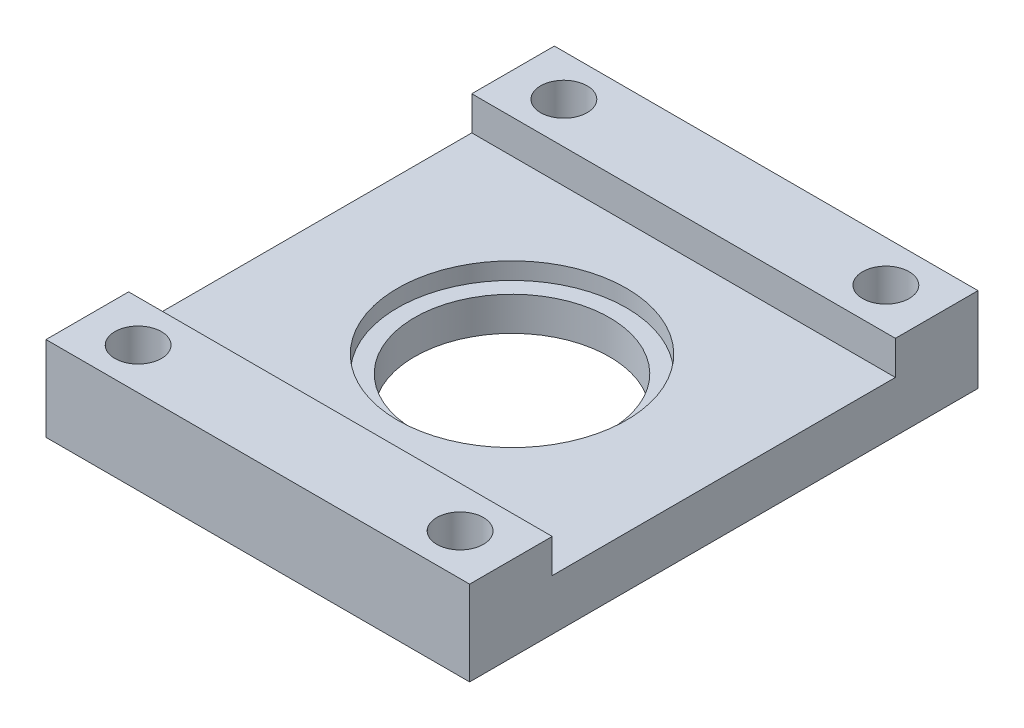
from build123d import *

# Parameters (mm, degrees)
SKETCH1_W           = 63.5
SKETCH1_H           = 76.2
BOSS_EXTRUDE1_DEPTH = 12.7
SKETCH2_W           = 63.5
SKETCH2_H           = 51.435
CUT_EXTRUDE1_DEPTH  = 5.08
SKETCH3_R           = 14.605
CUT_EXTRUDE2_DEPTH  = 7.62
SKETCH4_R           = 3.4925
CUT_EXTRUDE4_DEPTH  = 12.7
SKETCH6_R           = 17.145
CUT_EXTRUDE6_DEPTH  = 2.54


with BuildPart() as part:
    # Sketch1 → Boss-Extrude1 (new body)
    with BuildSketch(Plane(origin=(0, 0, 0), x_dir=(1, 0, 0), z_dir=(0, 1, 0))):
        with Locations((31.75, -38.1)):
            Rectangle(SKETCH1_W, SKETCH1_H)
    extrude(amount=BOSS_EXTRUDE1_DEPTH)

    # Sketch2 → Cut-Extrude1 (cut)
    with BuildSketch(Plane(origin=(0, 12.7, 0), x_dir=(1, 0, 0), z_dir=(0, 1, 0))):
        with Locations((31.75, -38.1)):
            Rectangle(SKETCH2_W, SKETCH2_H)
    extrude(amount=-CUT_EXTRUDE1_DEPTH, mode=Mode.SUBTRACT)

    # Sketch3 → Cut-Extrude2 (cut)
    with BuildSketch(Plane(origin=(0, 7.62, 0), x_dir=(1, 0, 0), z_dir=(0, 1, 0))):
        with Locations(Location((31.75, -38.1, 0), (0, 0, 270))):
            Circle(SKETCH3_R)
    extrude(amount=-CUT_EXTRUDE2_DEPTH, mode=Mode.SUBTRACT)

    # Sketch4 → Cut-Extrude4 (cut)
    with BuildSketch(Plane(origin=(0, 12.7, 0), x_dir=(1, 0, 0), z_dir=(0, 1, 0))):
        with Locations(Location((7.62, -6.19125, 0), (0, 0, 270))):
            Circle(SKETCH4_R)
        with Locations(Location((55.88, -6.19125, 0), (0, 0, 270))):
            Circle(SKETCH4_R)
        with Locations(Location((7.62, -70.00875, 0), (0, 0, 270))):
            Circle(SKETCH4_R)
        with Locations(Location((55.88, -70.00875, 0), (0, 0, 270))):
            Circle(SKETCH4_R)
    extrude(amount=-CUT_EXTRUDE4_DEPTH, mode=Mode.SUBTRACT)

    # Sketch6 → Cut-Extrude6 (cut)
    with BuildSketch(Plane(origin=(0, 7.62, 0), x_dir=(1, 0, 0), z_dir=(0, 1, 0))):
        with Locations(Location((31.75, -38.1, 0), (0, 0, 270))):
            Circle(SKETCH6_R)
    extrude(amount=-CUT_EXTRUDE6_DEPTH, mode=Mode.SUBTRACT)


solid = part.part
